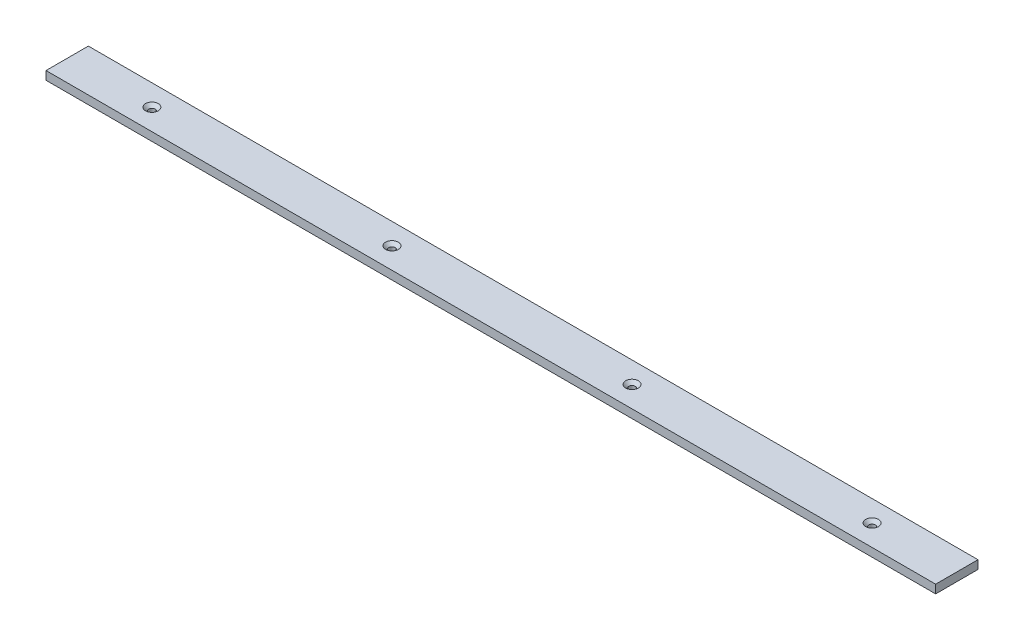
from build123d import *

# Parameters (mm, degrees)
SKETCH1_W           = 630
SKETCH1_H           = 30
BOSS_EXTRUDE1_DEPTH = 6
SKETCH4_R           = 2.25
CUT_EXTRUDE1_DEPTH  = 316.414013639
LPATTERN2_COUNT     = 4
LPATTERN2_PITCH     = 170


with BuildPart() as part:
    # Sketch1 → Boss-Extrude1 (new body)
    with BuildSketch(Plane(origin=(0, 0, 0), x_dir=(1, 0, 0), z_dir=(0, 1, 0))):
        Rectangle(SKETCH1_W, SKETCH1_H)
    extrude(amount=BOSS_EXTRUDE1_DEPTH)

    # Sketch4 → Cut-Extrude1 (cut, through all)
    with BuildSketch(Plane(origin=(0, 6, 0), x_dir=(1, 0, 0), z_dir=(0, 1, 0))):
        with Locations(Location((-255, 0, 0), (0, 0, 270))):
            Circle(SKETCH4_R)
    cut_extrude1 = extrude(amount=-CUT_EXTRUDE1_DEPTH, mode=Mode.SUBTRACT)

    # Cut-Extrude2 cone 1 section (through the dimple's axis) → Cut-Extrude2 (revolve, cut)
    with BuildSketch(Plane(origin=(-255, 6, 0), x_dir=(0, 0, 1), z_dir=(1, 0, 0))):
        Polygon((0, 0), (4.5, 0), (0, 4.5), align=None)
    cut_extrude2 = revolve(axis=Axis((-255, 6, 0), (0, -1, 0)), mode=Mode.SUBTRACT)

    # LPattern2: Cut-Extrude1, Cut-Extrude2 ×4
    with Locations(*[(i * LPATTERN2_PITCH, 0, 0) for i in range(1, LPATTERN2_COUNT)]):
        add(cut_extrude1, mode=Mode.SUBTRACT)
        add(cut_extrude2, mode=Mode.SUBTRACT)


solid = part.part
